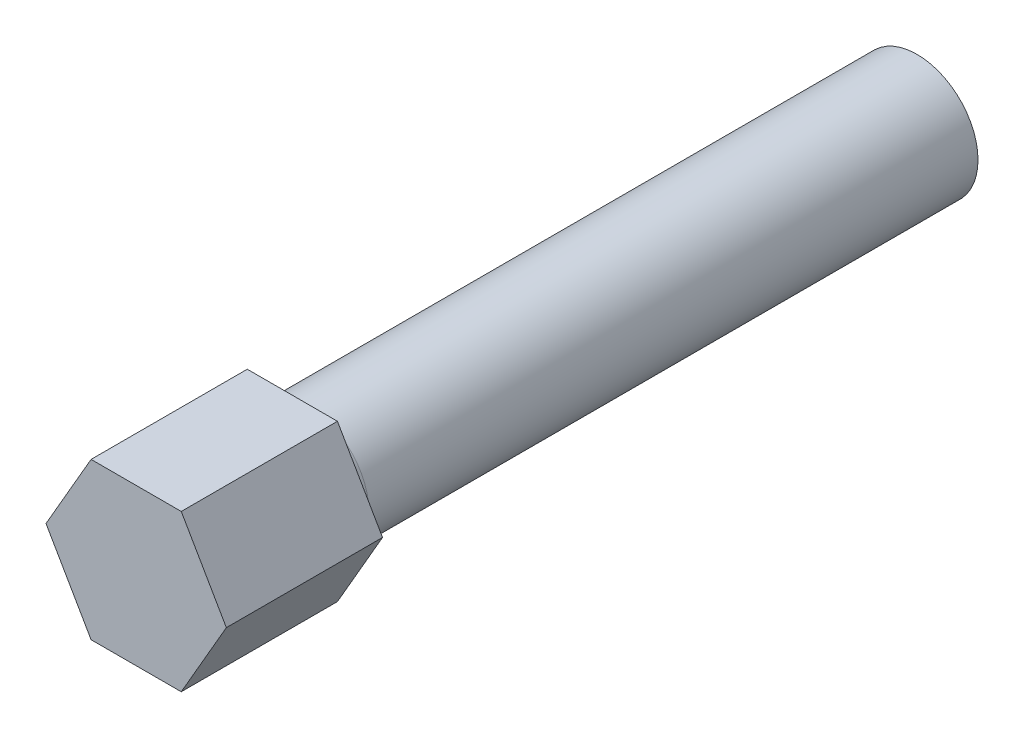
from build123d import *

# Parameters (mm, degrees)
SKETCH2_R           = 4.953
SKETCH2_R_2         = 2.032
BOSS_EXTRUDE1_DEPTH = 50.8
CUT_EXTRUDE1_DEPTH  = 3.302
BOSS_EXTRUDE2_DEPTH = 12.7
FILLET1_R           = 1.27


with BuildPart() as part:
    # Sketch2 → Boss-Extrude1 (new body)
    with BuildSketch(Plane.XY):
        Circle(SKETCH2_R)
        Circle(SKETCH2_R_2, mode=Mode.SUBTRACT)
    extrude(amount=BOSS_EXTRUDE1_DEPTH)

    # Sketch3 → Cut-Extrude1 (cut)
    with BuildSketch(Plane(origin=(0, 0, 0), x_dir=(-1, 0, 0), z_dir=(0, 0, -1))):
        Polygon((4.692702988, 0), (2.346351494, 4.064), (-2.346351494, 4.064), (-4.692702988, 0), (-2.346351494, -4.064), (2.346351494, -4.064), align=None)
    extrude(amount=-CUT_EXTRUDE1_DEPTH, mode=Mode.SUBTRACT)

    # Sketch4 → Boss-Extrude2 (add)
    with BuildSketch(Plane.XY.offset(50.8)):
        Polygon((7.332348419, 0), (3.666174209, 6.35), (-3.666174209, 6.35), (-7.332348419, 0), (-3.666174209, -6.35), (3.666174209, -6.35), align=None)
    extrude(amount=BOSS_EXTRUDE2_DEPTH)

    # Fillet1
    fillet1_edges = [part.edges().sort_by_distance(p)[0] for p in [
        (-4.953, 0, 50.8),
    ]]
    fillet(fillet1_edges, radius=FILLET1_R)


solid = part.part
